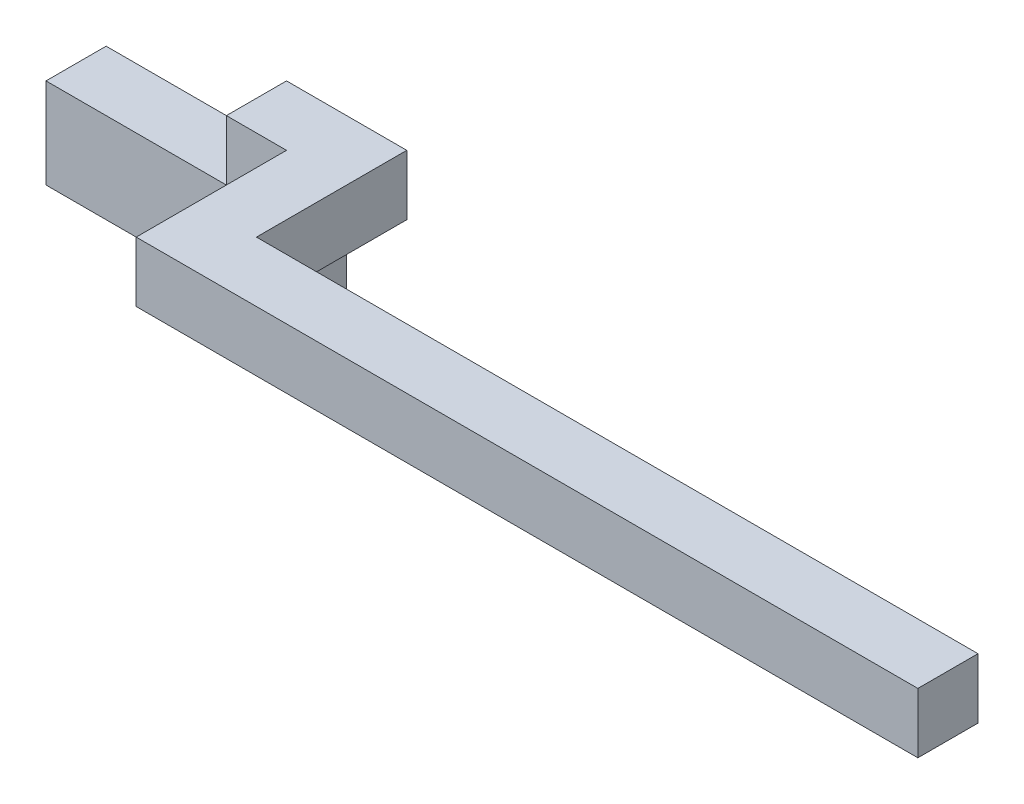
from build123d import *

# Parameters (mm, degrees)
SKETCH1_W           = 431.8
SKETCH1_H           = 63.5
BOSS_EXTRUDE1_DEPTH = 25.4
SKETCH2_W           = 330.2
SKETCH2_H           = 38.1
CUT_EXTRUDE1_DEPTH  = 334.35988061
SKETCH3_W           = 330.2
SKETCH3_H           = 25.4
BOSS_EXTRUDE2_DEPTH = 63.5
SKETCH4_W           = 76.2
SKETCH4_H           = 25.4
CUT_EXTRUDE2_DEPTH  = 339.4019799
SKETCH5_W           = 304.8
SKETCH5_H           = 63.5
CUT_EXTRUDE3_DEPTH  = 348.803824016
HOLE1_D             = 12.7
HOLE1_DEPTH         = 5.08


with BuildPart() as part:
    # Sketch1 → Boss-Extrude1 (new body)
    with BuildSketch(Plane.XY.offset(25.4)):
        with Locations((114.3, -6.35)):
            Rectangle(SKETCH1_W, SKETCH1_H)
    extrude(amount=-BOSS_EXTRUDE1_DEPTH)

    # Sketch2 → Cut-Extrude1 (cut, through all)
    with BuildSketch(Plane(origin=(0, 0, 0), x_dir=(-1, 0, 0), z_dir=(0, 0, -1))):
        with Locations((-165.1, -19.05)):
            Rectangle(SKETCH2_W, SKETCH2_H)
    extrude(amount=-CUT_EXTRUDE1_DEPTH, mode=Mode.SUBTRACT)

    # Sketch3 → Boss-Extrude2 (add)
    with BuildSketch(Plane.XY.offset(25.4)):
        with Locations((165.1, 12.7)):
            Rectangle(SKETCH3_W, SKETCH3_H)
    extrude(amount=BOSS_EXTRUDE2_DEPTH)

    # Sketch4 → Cut-Extrude2 (cut, through all)
    with BuildSketch(Plane.XY.offset(25.4)):
        with Locations((-63.5, 12.7)):
            Rectangle(SKETCH4_W, SKETCH4_H)
    extrude(amount=-CUT_EXTRUDE2_DEPTH, mode=Mode.SUBTRACT)

    # Sketch5 → Cut-Extrude3 (cut, through all)
    with BuildSketch(Plane(origin=(0, 25.4, 0), x_dir=(-1, 0, 0), z_dir=(0, 1, 0))):
        with Locations((-177.8, 31.75)):
            Rectangle(SKETCH5_W, SKETCH5_H)
    extrude(amount=-CUT_EXTRUDE3_DEPTH, mode=Mode.SUBTRACT)

    # Hole1
    with Locations(Plane(origin=(0, 0, 0), x_dir=(-1, 0, 0), z_dir=(0, 0, -1))):
        with Locations((-12.7, 12.7)):
            Hole(HOLE1_D / 2, depth=HOLE1_DEPTH)


solid = part.part
